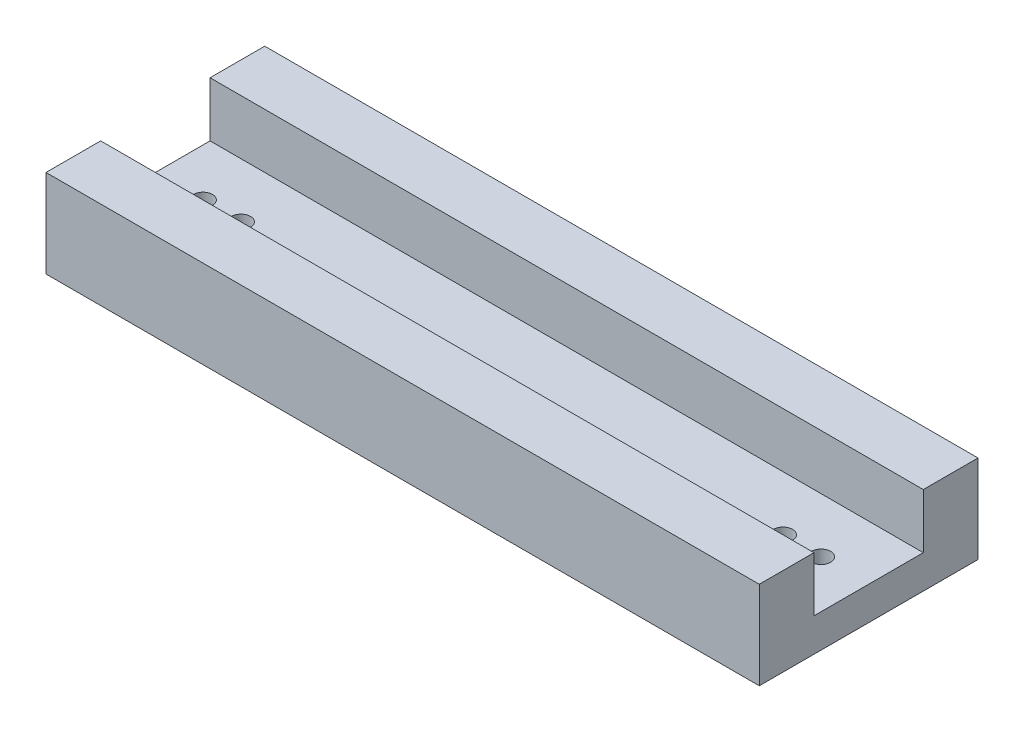
from build123d import *

# Parameters (mm, degrees)
EXTRUDE_1_DEPTH     = 150
SKETCH_2_R          = 2
CUT_EXTRUDE_1_DEPTH = 158.98180275


with BuildPart() as part:
    # 草图1 → 凸台-拉伸1 (new body)
    with BuildSketch(Plane(origin=(0, 0, 0), x_dir=(0, 0, -1), z_dir=(1, 0, 0))):
        Polygon((0, 18.5), (11.5, 18.5), (11.5, 7), (34.5, 7), (34.5, 18.5), (46, 18.5), (46, 0), (0, 0), align=None)
    extrude(amount=EXTRUDE_1_DEPTH)

    # 草图2 → 切除-拉伸1 (cut, through all)
    with BuildSketch(Plane(origin=(0, 0, 0), x_dir=(-1, 0, 0), z_dir=(0, -1, 0))):
        with Locations(Location((-140, 23, 0), (0, 0, 90))):
            Circle(SKETCH_2_R)
        with Locations(Location((-10, 23, 0), (0, 0, 90))):
            Circle(SKETCH_2_R)
        with Locations(Location((-132, 23, 0), (0, 0, 90))):
            Circle(SKETCH_2_R)
        with Locations(Location((-18, 23, 0), (0, 0, 90))):
            Circle(SKETCH_2_R)
    extrude(amount=-CUT_EXTRUDE_1_DEPTH, mode=Mode.SUBTRACT)


solid = part.part
